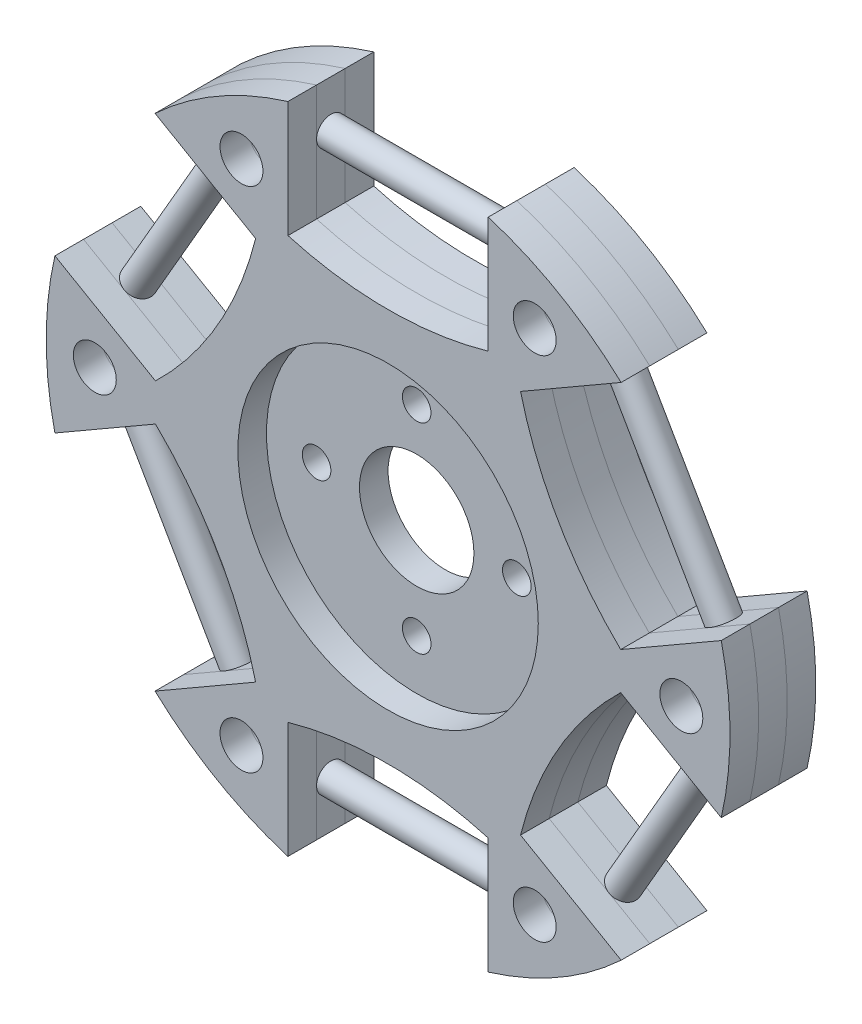
from build123d import *

# Parameters (mm, degrees)
SKETCH_1_R               = 25.4
SKETCH_1_R_2             = 10.5
EXTRUDE_1_DEPTH          = 2
SKETCH_2_R               = 25.4
SKETCH_2_R_2             = 4
EXTRUDE_2_DEPTH          = 2
SKETCH_3_R               = 25.4
SKETCH_3_R_2             = 10.5
EXTRUDE_3_DEPTH          = 2
CUT_EXTRUDE_START        = -20.5
CUT_EXTRUDE_1_DEPTH      = 20.5
SKETCH_5_R               = 1.5
CUT_EXTRUDE_2_DEPTH      = 20.5
SKETCH_6_R               = 1
EXTRUDE_4_DEPTH          = 14
PATTERN_CIRCULAR_1_COUNT = 6
SKETCH_7_R               = 1
CUT_EXTRUDE_3_DEPTH      = 14
SKETCH_8_R               = 33.9
SKETCH_8_R_2             = 23.9
CUT_EXTRUDE_1_2_DEPTH    = 10


with BuildPart() as part:
    # 草图1 → 凸台-拉伸1 (new body)
    with BuildSketch(Plane.XY):
        Circle(SKETCH_1_R)
        Circle(SKETCH_1_R_2, mode=Mode.SUBTRACT)
    extrude(amount=EXTRUDE_1_DEPTH)


with BuildPart() as body_2:
    # 草图2 → 凸台-拉伸2 (new body)
    with BuildSketch(Plane.XY.offset(2)):
        Circle(SKETCH_2_R)
        Circle(SKETCH_2_R_2, mode=Mode.SUBTRACT)
    extrude(amount=EXTRUDE_2_DEPTH)


with BuildPart() as body_3:
    # 草图3 → 凸台-拉伸3 (new body)
    with BuildSketch(Plane.XY.offset(4)):
        Circle(SKETCH_3_R)
        Circle(SKETCH_3_R_2, mode=Mode.SUBTRACT)
    extrude(amount=EXTRUDE_3_DEPTH)


with BuildPart() as cut_extrude_1_tool:
    # 草图4 → Cut-Extrude 1 (new body)
    with BuildSketch(Plane.XY.offset(6).offset(CUT_EXTRUDE_START)):
        with BuildLine():
            Line((9.259682334, 13.428983857), (17.645212224, 18.270371796))
            ThreePointArc((17.645212224, 18.270371796), (21.997045256, 12.7), (24.645212224, 6.146016143))
            Line((24.645212224, 6.146016143), (16.259682334, 1.304628204))
            ThreePointArc((16.259682334, 1.304628204), (11.907849302, 6.875), (9.259682334, 13.428983857))
        make_face()
        with BuildLine():
            Line((7, 14.733612061), (7, 24.416387939))
            ThreePointArc((7, 24.416387939), (0, 25.4), (-7, 24.416387939))
            Line((-7, 24.416387939), (-7, 14.733612061))
            ThreePointArc((-7, 14.733612061), (0, 13.75), (7, 14.733612061))
        make_face()
        with BuildLine():
            Line((16.259682334, -1.304628204), (24.645212224, -6.146016143))
            ThreePointArc((24.645212224, -6.146016143), (21.997045256, -12.7), (17.645212224, -18.270371796))
            Line((17.645212224, -18.270371796), (9.259682334, -13.428983857))
            ThreePointArc((9.259682334, -13.428983857), (11.907849302, -6.875), (16.259682334, -1.304628204))
        make_face()
        with BuildLine():
            Line((7, -14.733612061), (7, -24.416387939))
            ThreePointArc((7, -24.416387939), (0, -25.4), (-7, -24.416387939))
            Line((-7, -24.416387939), (-7, -14.733612061))
            ThreePointArc((-7, -14.733612061), (0, -13.75), (7, -14.733612061))
        make_face()
        with BuildLine():
            Line((-9.259682334, -13.428983857), (-17.645212224, -18.270371796))
            ThreePointArc((-17.645212224, -18.270371796), (-21.997045256, -12.7), (-24.645212224, -6.146016143))
            Line((-24.645212224, -6.146016143), (-16.259682334, -1.304628204))
            ThreePointArc((-16.259682334, -1.304628204), (-11.907849302, -6.875), (-9.259682334, -13.428983857))
        make_face()
        with BuildLine():
            Line((-16.259682334, 1.304628204), (-24.645212224, 6.146016143))
            ThreePointArc((-24.645212224, 6.146016143), (-21.997045256, 12.7), (-17.645212224, 18.270371796))
            Line((-17.645212224, 18.270371796), (-9.259682334, 13.428983857))
            ThreePointArc((-9.259682334, 13.428983857), (-11.907849302, 6.875), (-16.259682334, 1.304628204))
        make_face()
    extrude(amount=CUT_EXTRUDE_1_DEPTH)


with BuildPart() as part_1:
    add(part.part)

    # Cut-Extrude 1: cut by cut_extrude_1_tool
    add(cut_extrude_1_tool.part, mode=Mode.SUBTRACT)


with BuildPart() as body_2_1:
    add(body_2.part)

    # Cut-Extrude 1: cut by cut_extrude_1_tool
    add(cut_extrude_1_tool.part, mode=Mode.SUBTRACT)


with BuildPart() as body_3_1:
    add(body_3.part)

    # Cut-Extrude 1: cut by cut_extrude_1_tool
    add(cut_extrude_1_tool.part, mode=Mode.SUBTRACT)


with BuildPart() as cut_extrude_2_tool:
    # 草图5 → 切除-拉伸2 (new body)
    with BuildSketch(Plane.XY.offset(6)):
        with Locations((10.25, 17.753520778)):
            Circle(SKETCH_5_R)
        with Locations((20.5, 0)):
            Circle(SKETCH_5_R)
        with Locations((10.25, -17.753520778)):
            Circle(SKETCH_5_R)
        with Locations((-10.25, -17.753520778)):
            Circle(SKETCH_5_R)
        with Locations((-20.5, 0)):
            Circle(SKETCH_5_R)
        with Locations((-10.25, 17.753520778)):
            Circle(SKETCH_5_R)
    extrude(amount=-CUT_EXTRUDE_2_DEPTH)


with BuildPart() as part_2:
    add(part_1.part)

    # 切除-拉伸2: cut by cut_extrude_2_tool
    add(cut_extrude_2_tool.part, mode=Mode.SUBTRACT)


with BuildPart() as body_2_2:
    add(body_2_1.part)

    # 切除-拉伸2: cut by cut_extrude_2_tool
    add(cut_extrude_2_tool.part, mode=Mode.SUBTRACT)

    # 草图6 → 凸台-拉伸4 (add)
    with BuildSketch(Plane(origin=(-7, 0, 0), x_dir=(0, 0, -1), z_dir=(1, 0, 0))):
        with Locations(Location((-3, 19.575, 0), (0, 0, 180))):
            Circle(SKETCH_6_R)
    extrude_4 = extrude(amount=EXTRUDE_4_DEPTH)

    # 阵列(圆周)1: 凸台-拉伸4 ×6 about axis
    pattern_circular_1_axis = Axis((0, 0, 6), (0, 0, 1))
    for i in range(1, PATTERN_CIRCULAR_1_COUNT):
        add(extrude_4.rotate(pattern_circular_1_axis, i * 360 / PATTERN_CIRCULAR_1_COUNT))

    # 草图7 → 切除-拉伸3 (cut)
    with BuildSketch(Plane.XY.offset(4)):
        with Locations((-7, 0)):
            Circle(SKETCH_7_R)
        with Locations((0, 7)):
            Circle(SKETCH_7_R)
        with Locations((7, 0)):
            Circle(SKETCH_7_R)
        with Locations((0, -7)):
            Circle(SKETCH_7_R)
    extrude(amount=-CUT_EXTRUDE_3_DEPTH, mode=Mode.SUBTRACT)


with BuildPart() as body_3_2:
    add(body_3_1.part)

    # 切除-拉伸2: cut by cut_extrude_2_tool
    add(cut_extrude_2_tool.part, mode=Mode.SUBTRACT)


with BuildPart() as cut_extrude_1_2_tool:
    # 草图8 → Cut-Extrude 1 2 (new body)
    with BuildSketch(Plane.XY.offset(6)):
        Circle(SKETCH_8_R)
        Circle(SKETCH_8_R_2, mode=Mode.SUBTRACT)
    extrude(amount=-CUT_EXTRUDE_1_2_DEPTH)


with BuildPart() as part_3:
    add(part_2.part)

    # Cut-Extrude 1 2: cut by cut_extrude_1_2_tool
    add(cut_extrude_1_2_tool.part, mode=Mode.SUBTRACT)


with BuildPart() as body_2_3:
    add(body_2_2.part)

    # Cut-Extrude 1 2: cut by cut_extrude_1_2_tool
    add(cut_extrude_1_2_tool.part, mode=Mode.SUBTRACT)


with BuildPart() as body_3_3:
    add(body_3_2.part)

    # Cut-Extrude 1 2: cut by cut_extrude_1_2_tool
    add(cut_extrude_1_2_tool.part, mode=Mode.SUBTRACT)


solid = Compound([part_3.part, body_2_3.part, body_3_3.part])
